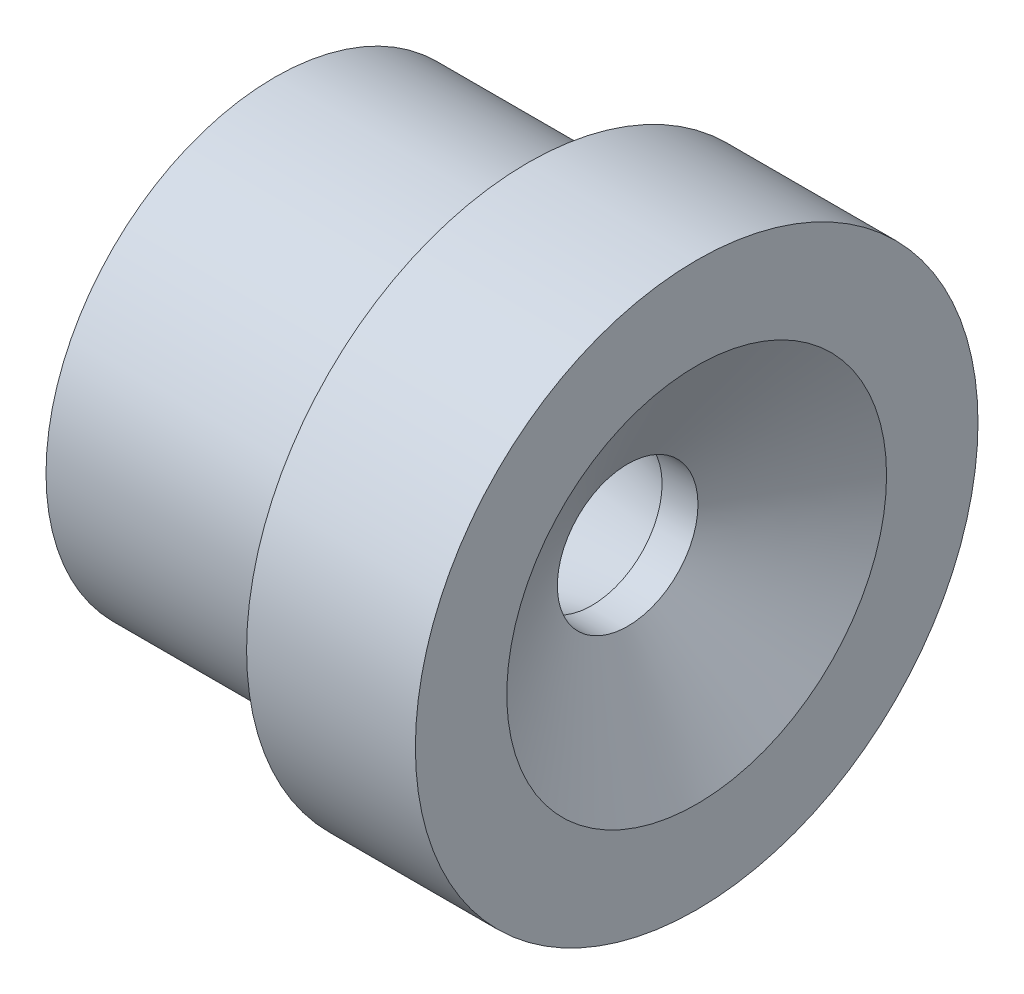
from build123d import *


with BuildPart() as part:
    # Sketch1 → Revolve1 (revolve)
    with BuildSketch(Plane(origin=(0, 0, 0), x_dir=(1, 0, 0), z_dir=(0, 1, 0)), mode=Mode.PRIVATE) as revolve1_sk:
        Polygon((0, 0), (0, 4.1275), (-3.116248078, 9.525), (-4.736768078, 9.525), (-19.05, 5.689781065), (-19.05, 2.3749), (-7.62, 2.3749), (-7.62, 0), align=None)
    revolve(revolve1_sk.sketch.rotate(Axis((5.118729701, 0, -12.7), (-1, 0, 0)), 180), axis=Axis((5.118729701, 0, -12.7), (-1, 0, 0)))


solid = part.part
